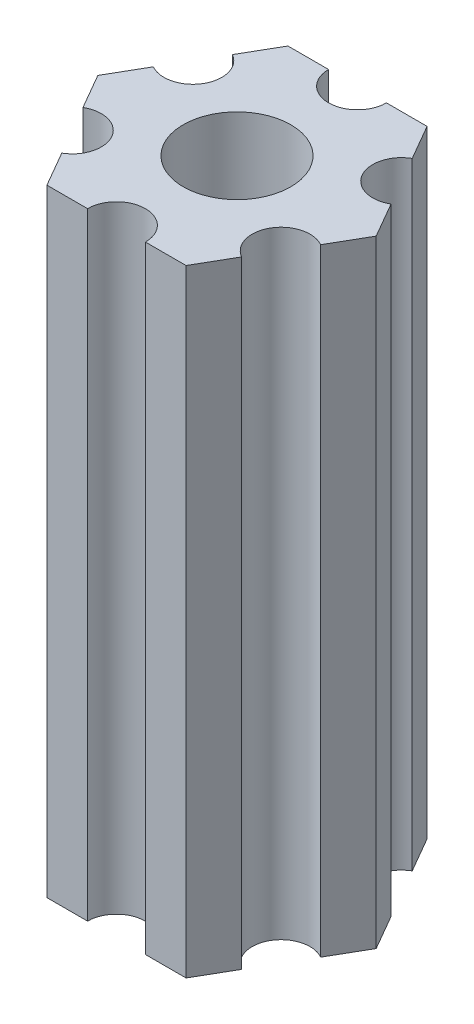
from build123d import *

# Parameters (mm, degrees)
ESBO_O1_R                = 2.79
RESSALTO_EXTRUS_O1_DEPTH = 32


with BuildPart() as part:
    # Esboço1 → Ressalto-extrusão1 (new body)
    with BuildSketch(Plane(origin=(0, 85, 0), x_dir=(1, 0, 0), z_dir=(0, 1, 0))):
        with BuildLine():
            Line((6.162658774, -1.825961894), (7.216878365, 0))
            Line((7.216878365, 0), (6.162658774, 1.825961894))
            ThreePointArc((6.162658774, 1.825961894), (4.113620668, 2.375), (4.662658774, 4.424038106))
            Line((4.662658774, 4.424038106), (3.608439182, 6.25))
            Line((3.608439182, 6.25), (1.5, 6.25))
            ThreePointArc((1.5, 6.25), (0, 4.75), (-1.5, 6.25))
            Line((-1.5, 6.25), (-3.608439182, 6.25))
            Line((-3.608439182, 6.25), (-4.662658774, 4.424038106))
            ThreePointArc((-4.662658774, 4.424038106), (-4.113620668, 2.375), (-6.162658774, 1.825961894))
            Line((-6.162658774, 1.825961894), (-7.216878365, 0))
            Line((-7.216878365, 0), (-6.162658774, -1.825961894))
            ThreePointArc((-6.162658774, -1.825961894), (-4.113620668, -2.375), (-4.662658774, -4.424038106))
            Line((-4.662658774, -4.424038106), (-3.608439182, -6.25))
            Line((-3.608439182, -6.25), (-1.5, -6.25))
            ThreePointArc((-1.5, -6.25), (0, -4.75), (1.5, -6.25))
            Line((1.5, -6.25), (3.608439182, -6.25))
            Line((3.608439182, -6.25), (4.662658774, -4.424038106))
            ThreePointArc((4.662658774, -4.424038106), (4.113620668, -2.375), (6.162658774, -1.825961894))
        make_face()
        with Locations(Location((0, 0, 0), (0, 0, 90))):
            Circle(ESBO_O1_R, mode=Mode.SUBTRACT)
    extrude(amount=-RESSALTO_EXTRUS_O1_DEPTH)


solid = part.part
